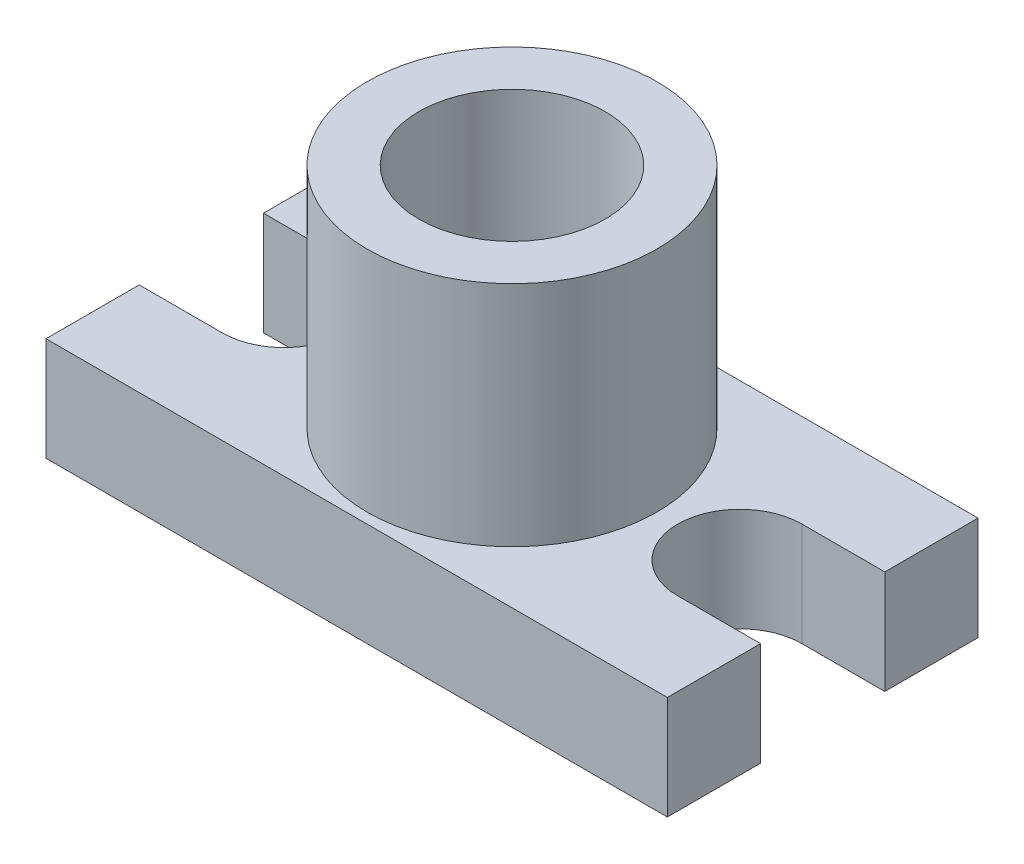
from build123d import *

# Parameters (mm, degrees)
EXTRUDE_1_DEPTH     = 5
SKETCH_3_R          = 7
SKETCH_3_R_2        = 4.5
EXTRUDE_2_DEPTH     = 11
SKETCH_3_3_R        = 4.5
CUT_EXTRUDE_1_DEPTH = 21.05617112


with BuildPart() as part:
    # 草图2 → 凸台-拉伸1 (new body)
    with BuildSketch(Plane(origin=(0, 0, 0), x_dir=(1, 0, 0), z_dir=(0, 1, 0))):
        with BuildLine():
            Line((-15, -7.5), (15, -7.5))
            Line((15, -7.5), (15, -3))
            Line((15, -3), (11, -3))
            ThreePointArc((11, -3), (8, 0), (11, 3))
            Line((11, 3), (15, 3))
            Line((15, 3), (15, 7.5))
            Line((15, 7.5), (-15, 7.5))
            Line((-15, 7.5), (-15, 3))
            Line((-15, 3), (-11, 3))
            ThreePointArc((-11, 3), (-8, 0), (-11, -3))
            Line((-11, -3), (-15, -3))
            Line((-15, -3), (-15, -7.5))
        make_face()
    extrude(amount=EXTRUDE_1_DEPTH)

    # 草图3 → 凸台-拉伸2 (add)
    with BuildSketch(Plane(origin=(0, 5, 0), x_dir=(1, 0, 0), z_dir=(0, 1, 0))):
        Circle(SKETCH_3_R)
        Circle(SKETCH_3_R_2, mode=Mode.SUBTRACT)
    extrude(amount=EXTRUDE_2_DEPTH)

    # 草图3<3> → 切除-拉伸1 (cut, through all)
    with BuildSketch(Plane(origin=(0, 5, 0), x_dir=(1, 0, 0), z_dir=(0, 1, 0))):
        Circle(SKETCH_3_3_R)
    extrude(amount=-CUT_EXTRUDE_1_DEPTH, mode=Mode.SUBTRACT)


solid = part.part
